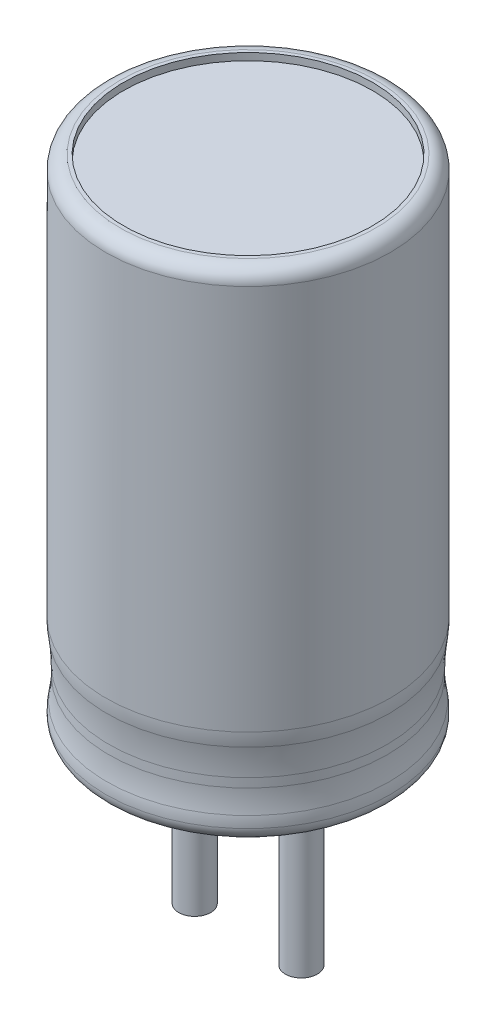
from build123d import *

# Parameters (mm, degrees)
SKETCH2_R          = 1.75
CUT_EXTRUDE1_DEPTH = 0.1
SKETCH4_W          = 0.225
SKETCH4_H          = 2.5
FILLET1_R          = 0.2


with BuildPart() as part:
    # Sketch1 → Revolve1 (revolve)
    with BuildSketch(Plane.XY):
        with BuildLine():
            Line((2, 7), (0, 7))
            Line((0, 7), (0, 0))
            Line((0, 0), (1.970115999, 0))
            ThreePointArc((1.970115999, 0), (1.997744783, 0.172945308), (1.985594939, 0.347661679))
            ThreePointArc((1.985594939, 0.347661679), (1.963952003, 0.504056499), (1.956717438, 0.661775925))
            Line((1.956717438, 0.661775925), (1.956717438, 0.788075836))
            ThreePointArc((1.956717438, 0.788075836), (1.963946646, 0.983958609), (1.985594939, 1.178775635))
            ThreePointArc((1.985594939, 1.178775635), (1.99639383, 1.275956871), (2, 1.373669737))
            Line((2, 1.373669737), (2, 7))
        make_face()
    revolve(axis=Axis((0, 7, 0), (0, -1, 0)))

    # Sketch2 → Cut-Extrude1 (cut)
    with BuildSketch(Plane(origin=(0, 7, 0), x_dir=(-1, 0, 0), z_dir=(0, 1, 0))):
        with Locations(Location((0, 0, 0), (0, 0, 270))):
            Circle(SKETCH2_R)
    extrude(amount=-CUT_EXTRUDE1_DEPTH, mode=Mode.SUBTRACT)

    # Sketch4 → Revolve2 (revolve)
    with BuildSketch(Plane(origin=(0, 0, 0), x_dir=(-1, 0, 0), z_dir=(0, 0, -1)), mode=Mode.PRIVATE) as revolve2_sk:
        with Locations((-0.8625, -1.25)):
            Rectangle(SKETCH4_W, SKETCH4_H)
    revolve2 = revolve(revolve2_sk.sketch.rotate(Axis((0.75, -2.5, 0), (0, 1, 0)), 270), axis=Axis((0.75, -2.5, 0), (0, 1, 0)))

    # Fillet1
    fillet1_edges = [part.edges().sort_by_distance(p)[0] for p in [
        (-2, 7, 0),
        (-1.970115999, 0, 0),
    ]]
    fillet(fillet1_edges, radius=FILLET1_R)

    # Simetría3: Revolve2 across plane
    add(revolve2.mirror(Plane(origin=(0, 0, 0), x_dir=(0, 0, 1), z_dir=(1, 0, 0))))


solid = part.part
